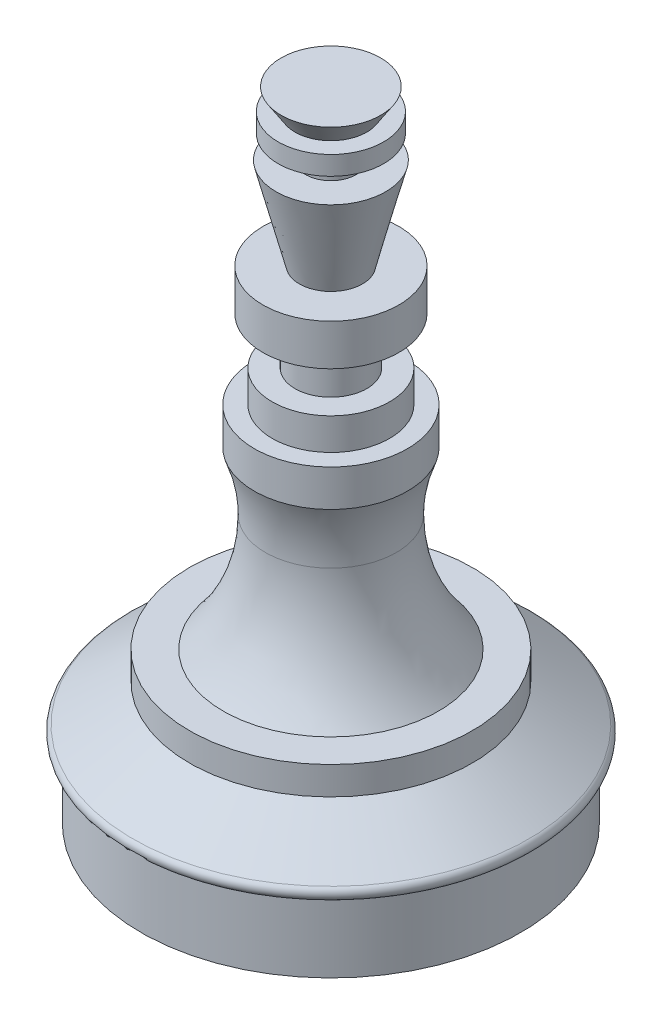
from build123d import *

# Parameters (mm, degrees)
SCALE_1_SCALE = 1.5


with BuildPart() as part:
    # 草圖2 → 旋轉1 (revolve)
    with BuildSketch(Plane.XY, mode=Mode.PRIVATE) as revolve_1_sk:
        with BuildLine():
            Line((0, 0), (135.201465244, 0))
            Line((135.201465244, 0), (135.201465244, 48.846470305))
            ThreePointArc((135.201465244, 48.846470305), (135.933698291, 50.614237258), (137.701465244, 51.346470305))
            Line((137.701465244, 51.346470305), (138.117818628, 51.346470305))
            ThreePointArc((138.117818628, 51.346470305), (142.905095232, 54.903562575), (140.880857994, 60.513677218))
            Line((140.880857994, 60.513677218), (100.681841945, 87.167372643))
            Line((100.681841945, 87.167372643), (100.681841945, 107.133121487))
            Line((100.681841945, 107.133121487), (76.60549775, 107.133121487))
            ThreePointArc((76.60549775, 107.133121487), (54.387004145, 145.940882587), (46.656874484, 189.985733309))
            ThreePointArc((46.656874484, 189.985733309), (48.623022714, 211.196335783), (54.479774894, 231.676908287))
            Line((54.479774894, 231.676908287), (54.479774894, 257.848515079))
            Line((54.479774894, 257.848515079), (41.803489055, 257.848515079))
            Line((41.803489055, 257.848515079), (41.803489055, 280.427838471))
            Line((41.803489055, 280.427838471), (25.557390517, 280.427838471))
            Line((25.557390517, 280.427838471), (25.557390517, 314.091902385))
            Line((25.557390517, 314.091902385), (48.412071511, 314.091902385))
            Line((48.412071511, 314.091902385), (48.412071511, 343.442796825))
            Line((48.412071511, 343.442796825), (22.495215746, 343.442796825))
            Line((22.495215746, 343.442796825), (39.007295277, 408.518950092))
            Line((39.007295277, 408.518950092), (17.96096835, 408.518950092))
            Line((17.96096835, 408.518950092), (17.96096835, 425.053771457))
            Line((17.96096835, 425.053771457), (37.557793671, 425.053771457))
            Line((37.557793671, 425.053771457), (37.557793671, 438.526588864))
            Line((37.557793671, 438.526588864), (25.557390517, 438.526588864))
            Line((25.557390517, 438.526588864), (35.414390901, 453.836608646))
            Line((35.414390901, 453.836608646), (0, 453.836608646))
            Line((0, 453.836608646), (0, 0))
        make_face()
    revolve(revolve_1_sk.sketch.rotate(Axis((0, 453.836608646, 0), (0, -1, 0)), 180), axis=Axis((0, 453.836608646, 0), (0, -1, 0)))


with BuildPart() as part_1:
    # 縮放比例1: scaled about (0, 100.72058529, 0)
    add(part.part.scale(SCALE_1_SCALE).moved(Location((0, -50.360292645, 0))))


solid = part_1.part
